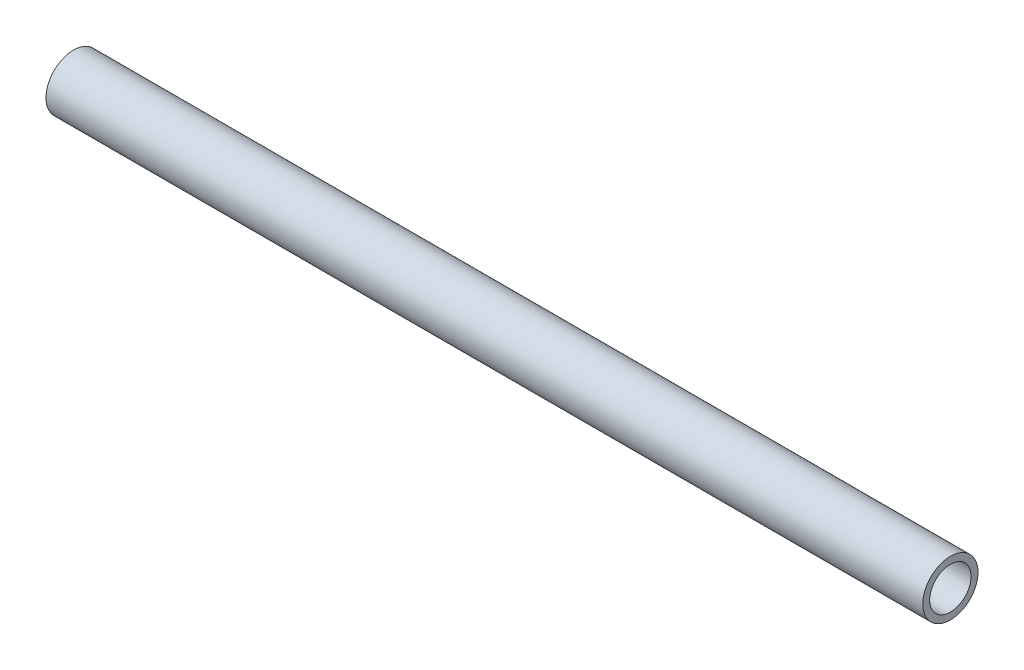
from build123d import *

# Parameters (mm, degrees)
SKETCH1_R   = 4
SKETCH1_R_2 = 3


with BuildPart() as part:
    # Sweep1: sweep along a curve in space
    with BuildLine() as sweep1_path:
        Line((0, 0, 0), (127, 0, 0))
    # Sketch1 → Sweep1 (sweep)
    with BuildSketch(Plane(origin=(0, 0, 0), x_dir=(0, 0, -1), z_dir=(1, 0, 0))):
        Circle(SKETCH1_R)
        Circle(SKETCH1_R_2, mode=Mode.SUBTRACT)
    sweep(path=sweep1_path.line)


solid = part.part
